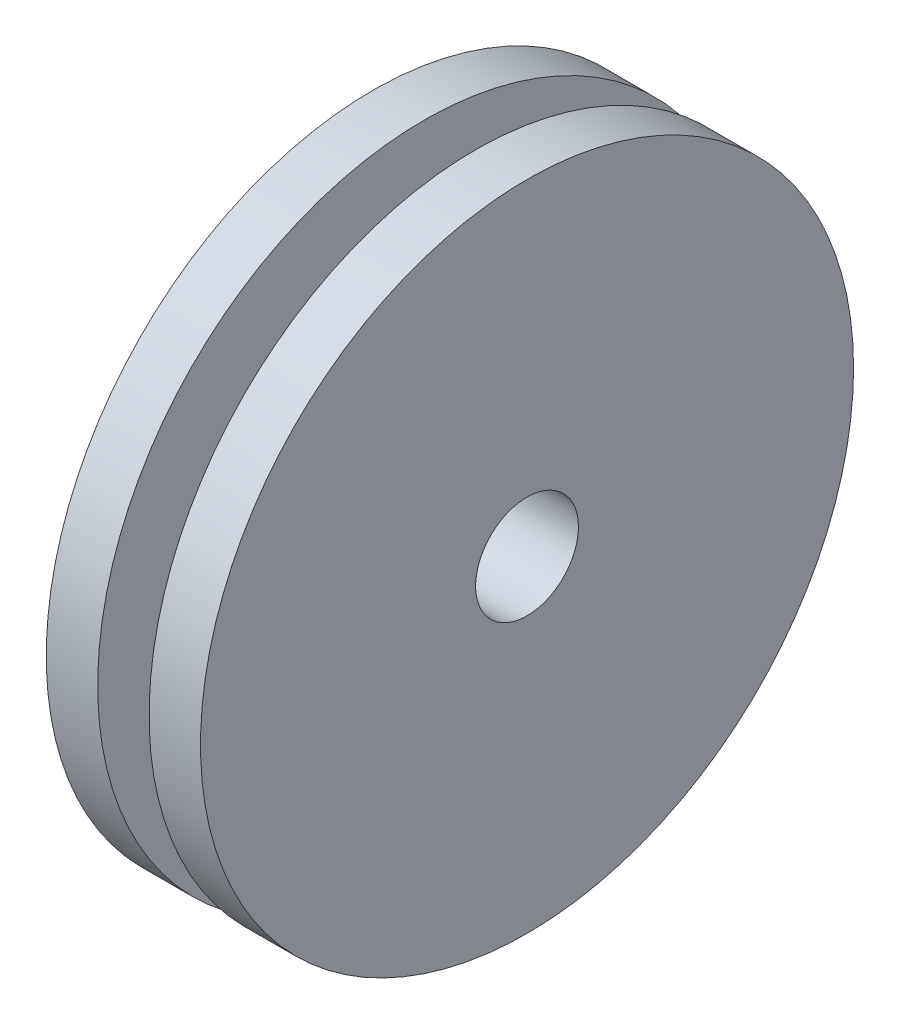
from build123d import *


with BuildPart() as part:
    # Esboço1 → Revolução1 (revolve)
    with BuildSketch(Plane.XY, mode=Mode.PRIVATE) as revolu_o1_sk:
        Polygon((-6, 4), (-6, 25.4), (-2, 25.4), (-2, 19.4), (2, 19.4), (2, 25.4), (6, 25.4), (6, 4), align=None)
    revolve(revolu_o1_sk.sketch.rotate(Axis((0, 0, 0), (-1, 0, 0)), 90), axis=Axis((0, 0, 0), (-1, 0, 0)))


solid = part.part
